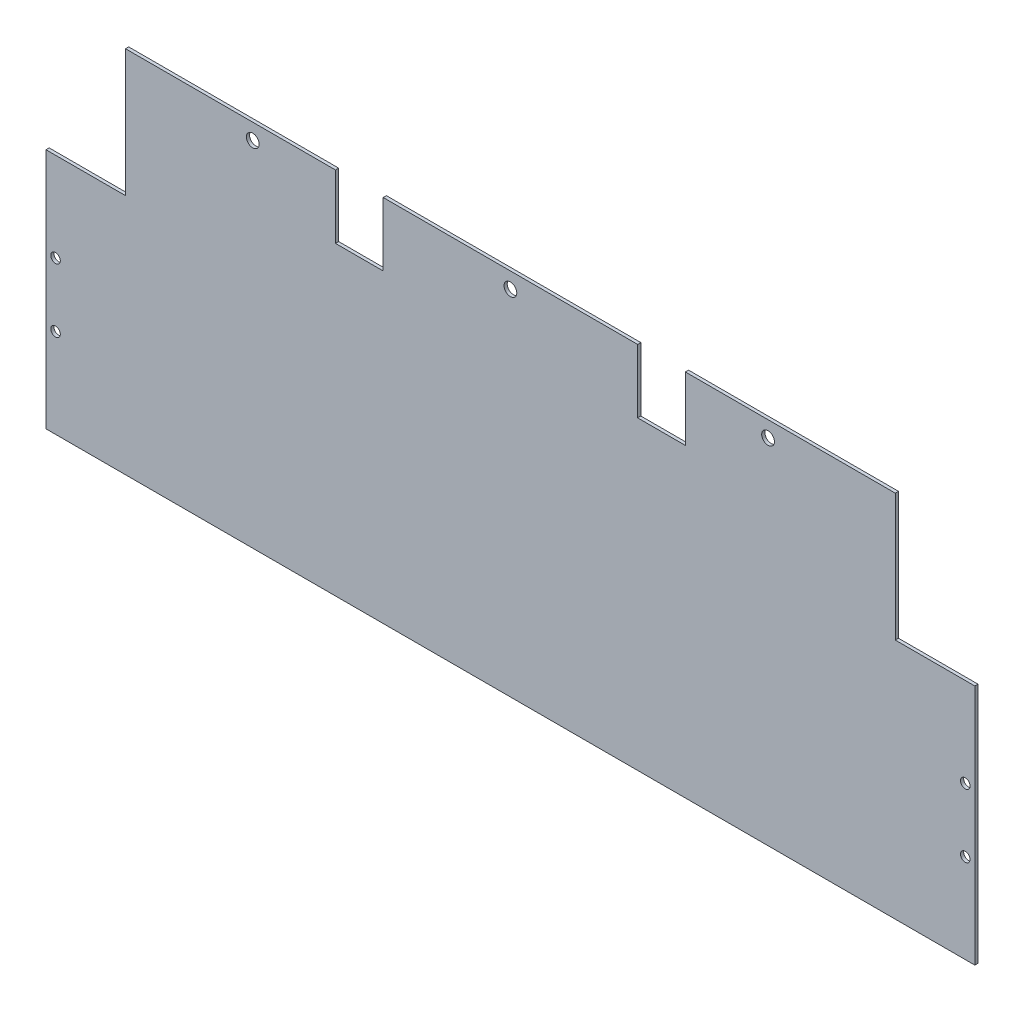
from build123d import *

# Parameters (mm, degrees)
SKETCH_1_R          = 1.5
EXTRUDE_1_DEPTH     = 1
SKETCH_2_R          = 2
SKETCH_2_W          = 15
SKETCH_2_H          = 20
CUT_EXTRUDE_1_DEPTH = 315.198981539


with BuildPart() as part:
    # 草图1 → 凸台-拉伸1 (new body)
    with BuildSketch(Plane.XY):
        Polygon((0, 0), (0, 76), (25, 76), (25, 116), (267, 116), (267, 76), (292, 76), (292, 0), align=None)
        with Locations((3, 48)):
            Circle(SKETCH_1_R, mode=Mode.SUBTRACT)
        with Locations((3, 28)):
            Circle(SKETCH_1_R, mode=Mode.SUBTRACT)
        with Locations(Location((289, 28, 0), (0, 0, 180))):
            Circle(SKETCH_1_R, mode=Mode.SUBTRACT)
        with Locations(Location((289, 48, 0), (0, 0, 180))):
            Circle(SKETCH_1_R, mode=Mode.SUBTRACT)
    extrude(amount=EXTRUDE_1_DEPTH)

    # 草图2 → 切除-拉伸1 (cut, through all)
    with BuildSketch(Plane.XY.offset(1)):
        with Locations((65, 111)):
            Circle(SKETCH_2_R)
        with Locations(Location((227, 111, 0), (0, 0, 180))):
            Circle(SKETCH_2_R)
        with Locations((146, 111)):
            Circle(SKETCH_2_R)
        with Locations((193.5, 106)):
            Rectangle(SKETCH_2_W, SKETCH_2_H)
        with Locations((98.5, 106)):
            Rectangle(SKETCH_2_W, SKETCH_2_H)
    extrude(amount=-CUT_EXTRUDE_1_DEPTH, mode=Mode.SUBTRACT)


solid = part.part
